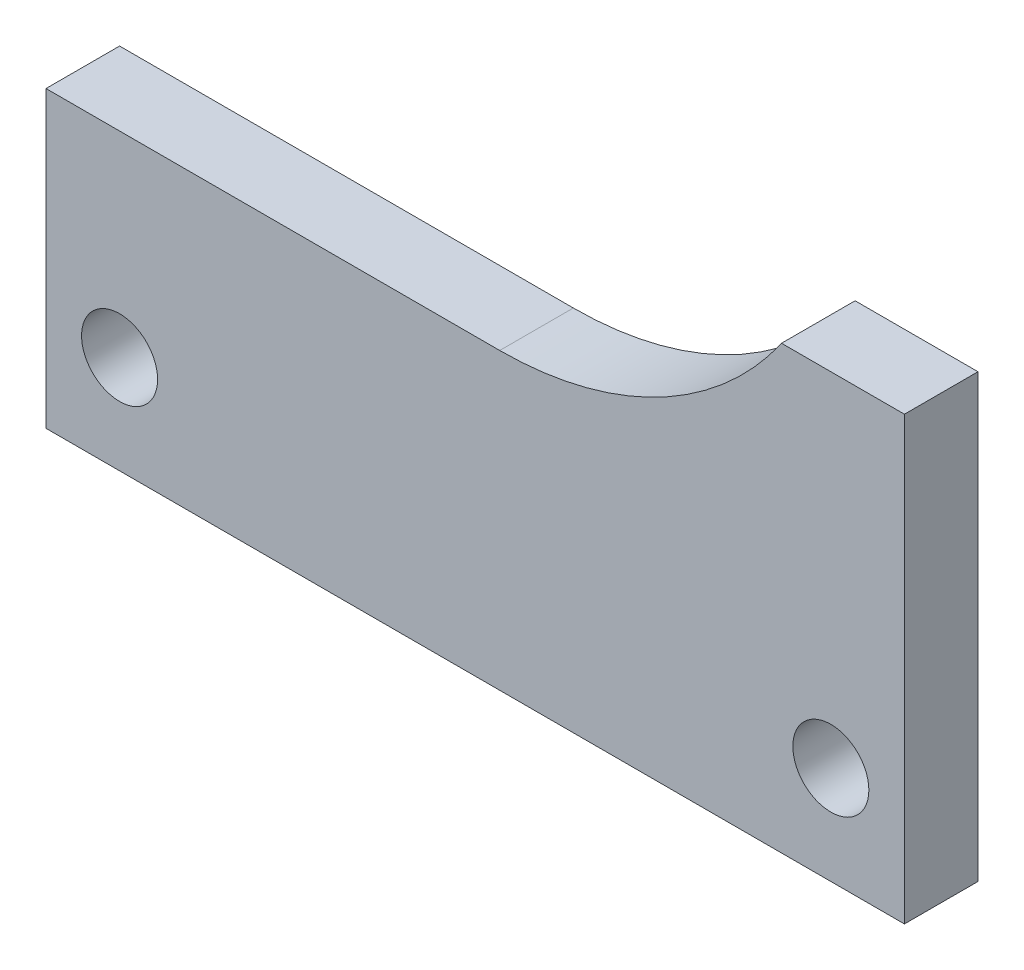
from build123d import *

# Parameters (mm, degrees)
SKETCH1_R           = 1.55
BOSS_EXTRUDE1_DEPTH = 3


with BuildPart() as part:
    # Sketch1 → Boss-Extrude1 (new body)
    with BuildSketch(Plane.XY):
        with BuildLine():
            Line((46.57384356, 8.887676402), (45.062968853, 8.887676402))
            ThreePointArc((45.062968853, 8.887676402), (40.054584258, 4.478002756), (33.57384356, 2.887676402))
            Line((33.57384356, 2.887676402), (15.07384356, 2.887676402))
            Line((15.07384356, 2.887676402), (15.07384356, 0.887676439))
            Line((15.07384356, 0.887676439), (15.07384356, -1.112323636))
            Line((15.07384356, -1.112323636), (15.07384356, -9.112323598))
            Line((15.07384356, -9.112323598), (50.07384356, -9.112323598))
            Line((50.07384356, -9.112323598), (50.07384356, 8.887676402))
            Line((50.07384356, 8.887676402), (48.573843574, 8.887676402))
            Line((48.573843574, 8.887676402), (46.57384356, 8.887676402))
        make_face()
        with Locations((18.07384356, -5.112323598)):
            Circle(SKETCH1_R, mode=Mode.SUBTRACT)
        with Locations((47.07384356, -5.112323598)):
            Circle(SKETCH1_R, mode=Mode.SUBTRACT)
    extrude(amount=BOSS_EXTRUDE1_DEPTH)


solid = part.part
